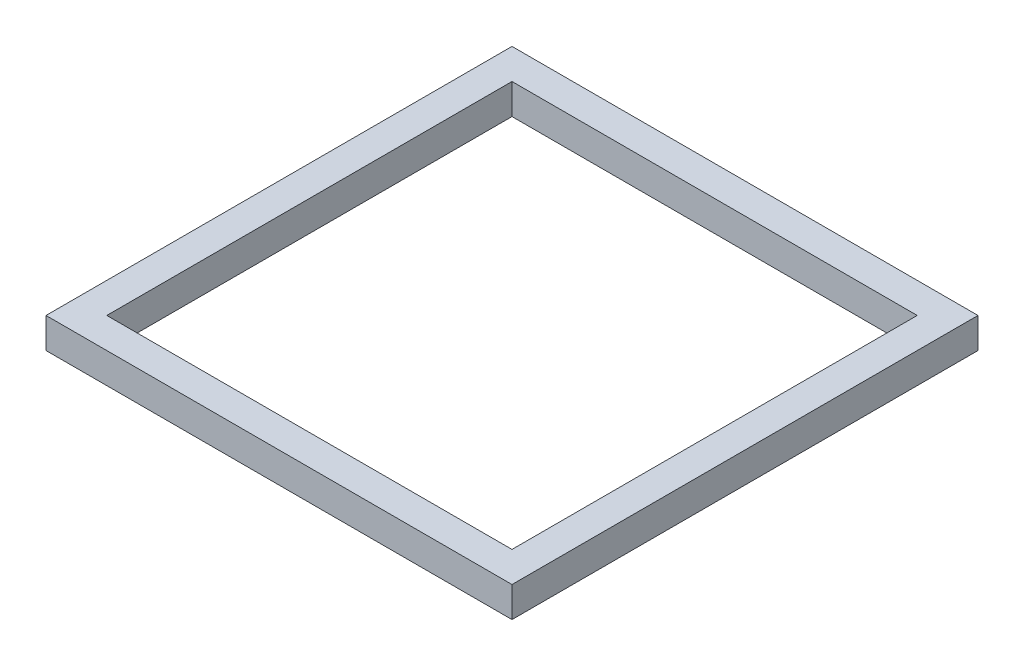
from build123d import *

# Parameters (mm, degrees)
SKETCH_1_W      = 230
SKETCH_1_H      = 230
SKETCH_1_W_2    = 200
SKETCH_1_H_2    = 200
EXTRUDE_1_DEPTH = 15


with BuildPart() as part:
    # 草图1 → 凸台-拉伸1 (new body)
    with BuildSketch(Plane(origin=(0, 0, 0), x_dir=(1, 0, 0), z_dir=(0, 1, 0))):
        Rectangle(SKETCH_1_W, SKETCH_1_H)
        Rectangle(SKETCH_1_W_2, SKETCH_1_H_2, mode=Mode.SUBTRACT)
    extrude(amount=EXTRUDE_1_DEPTH)


solid = part.part
